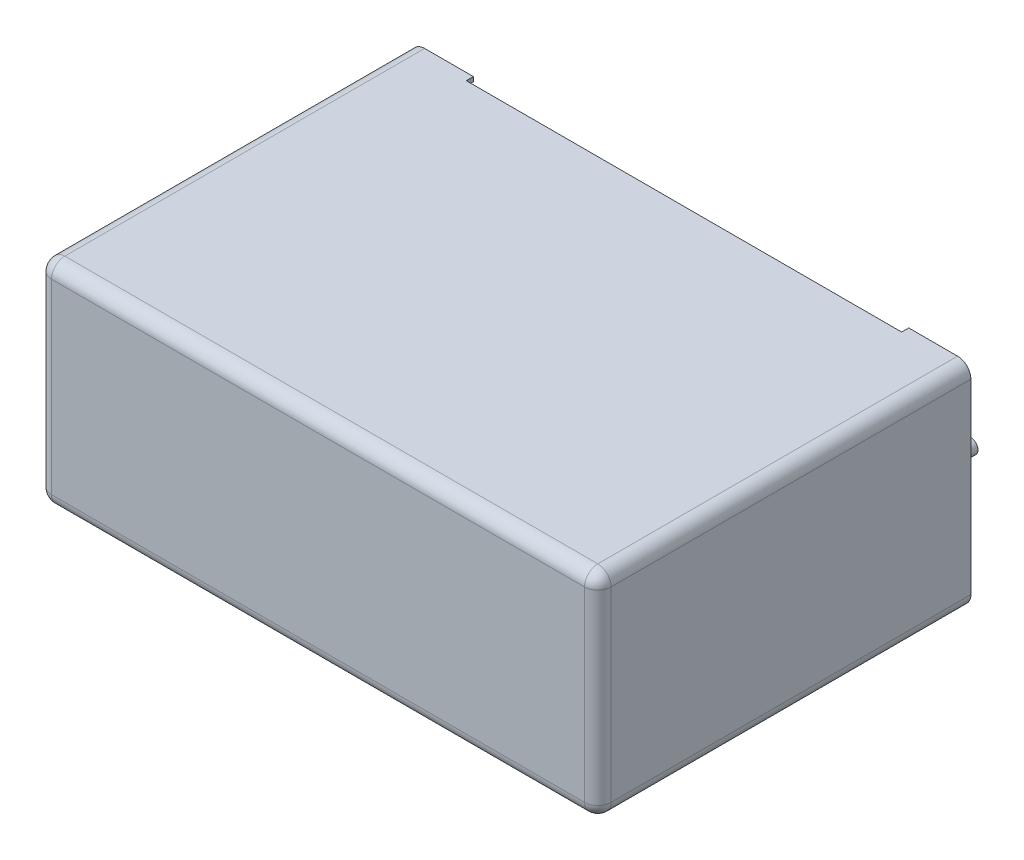
from build123d import *

# Parameters (mm, degrees)
SKETCH1_W               = 31.5
SKETCH1_H               = 12
EXTRUDE1_DEPTH          = 21
FILLET1_R               = 0.75
BOSS_EXTRUDE1_DEPTH     = 0.01
SKETCH4_W               = 31
SKETCH4_H               = 11.5
CUT_EXTRUDE1_DEPTH      = 0.5
CUT_EXTRUDE5_DEPTH      = 29.862822107
CUT_EXTRUDE5_DEPTH_BACK = 12
SKETCH5_W               = 24.5
SKETCH5_H               = 0.4
SKETCH2_R               = 0.4
EXTRUDE2_DEPTH          = 2.5


with BuildPart() as part:
    # Sketch1 → Extrude1 (new body)
    with BuildSketch(Plane.XY):
        Rectangle(SKETCH1_W, SKETCH1_H)
    extrude(amount=EXTRUDE1_DEPTH)

    # Fillet1
    fillet1_edges = [part.edges().sort_by_distance(p)[0] for p in [
        (15.75, 0, 21),
        (0, 6, 21),
        (-15.75, 0, 21),
        (0, -6, 21),
        (-15.75, 6, 10.5),
        (15.75, 6, 10.5),
        (15.75, -6, 10.5),
        (-15.75, -6, 10.5),
    ]]
    fillet(fillet1_edges, radius=FILLET1_R)

    # Sketch3 → Boss-Extrude1 (add)
    # profile 1 of 16: a face of its own
    with BuildSketch(Plane.XZ.offset(6)):
        Polygon((-4.080689103, 14.247652538), (-3.871121294, 15.835152538), (-3.85076873, 15.835152538), (-3.195352564, 14.532588435), (-2.541526442, 15.835152538), (-2.520855869, 15.835152538), (-2.310016026, 14.247652538), (-2.453119992, 14.247652538), (-2.605128205, 15.389940198), (-3.178180088, 14.247652538), (-3.210298978, 14.247652538), (-3.785576923, 15.392484269), (-3.937267127, 14.247652538), align=None)
    # profile 2 of 16: a face of its own
    with BuildSketch(Plane.XZ.offset(6)):
        Polygon((-1.984375, 15.835152538), (-1.841907051, 15.835152538), (-1.841907051, 15.230617782), (-1.180130709, 15.835152538), (-0.976923077, 15.835152538), (-1.756998698, 15.122812794), (-0.915865385, 14.247652538), (-1.105716647, 14.247652538), (-1.841907051, 15.013735771), (-1.841907051, 14.247652538), (-1.984375, 14.247652538), align=None)
    # profile 3 of 16: a face of its own
    with BuildSketch(Plane.XZ.offset(6)):
        with BuildLine():
            Line((-0.681810897, 15.835152538), (-0.370480268, 15.835152538))
            add(Edge.make_bspline(
                [(-0.370480268, 15.835152538), (-0.34906675, 15.835128999), (-0.308037499, 15.835083898), (-0.249202455, 15.833716496), (-0.195767327, 15.831890103), (-0.147847333, 15.829358316), (-0.105295031, 15.826366291), (-0.06830297, 15.82216983), (-0.036580386, 15.817788196), (-0.017572818, 15.813333487), (-0.008904247, 15.811301877)],
                knots=[0, 0, 0, 0, 1.415646017, 2.712440637, 3.8905458, 4.950247383, 5.884950622, 6.709939814, 7.411656543, 8, 8, 8, 8], degree=3))
            add(Edge.make_bspline(
                [(-0.008904247, 15.811301877), (0.002069249, 15.80829835), (0.023757664, 15.802362069), (0.055009208, 15.790472273), (0.084742559, 15.776374291), (0.113059731, 15.760307004), (0.139612747, 15.741581052), (0.164797773, 15.720955518), (0.188392549, 15.6979542), (0.210264395, 15.672835078), (0.230350714, 15.64601984), (0.247645249, 15.617108186), (0.262126526, 15.586586773), (0.274546796, 15.554476832), (0.283485988, 15.520508721), (0.290220117, 15.484918462), (0.294494406, 15.447709871), (0.294903782, 15.422282717), (0.295112179, 15.409338736)],
                knots=[0, 0, 0, 0, 0.999701418, 1.975846123, 2.934577507, 3.890451536, 4.834027766, 5.787354733, 6.749476667, 7.726910423, 8.712836071, 9.690891519, 10.682875813, 11.679750201, 12.712814741, 13.765529915, 14.8625177, 16, 16, 16, 16], degree=3))
            add(Edge.make_bspline(
                [(0.295112179, 15.409338736), (0.294921033, 15.396285958), (0.294547043, 15.370747318), (0.290058371, 15.333385375), (0.284012176, 15.297680962), (0.274715299, 15.263713247), (0.262538869, 15.231683951), (0.248254973, 15.201103607), (0.231026729, 15.17249247), (0.211230682, 15.14574667), (0.189209066, 15.120841103), (0.165055054, 15.097956249), (0.138866161, 15.077226067), (0.110725615, 15.058604083), (0.080359077, 15.042522128), (0.0482271, 15.028117921), (0.014050395, 15.01602069), (-0.00959996, 15.009657055), (-0.021624599, 15.006421568)],
                knots=[0, 0, 0, 0, 1.121902311, 2.195077645, 3.232258892, 4.234102512, 5.217864754, 6.176164875, 7.132989551, 8.084763148, 9.034132444, 9.988522005, 10.94243251, 11.903244335, 12.886203696, 13.894208494, 14.929344452, 16, 16, 16, 16], degree=3))
            add(Edge.make_bspline(
                [(-0.021624599, 15.006421568), (-0.031570212, 15.004306573), (-0.053366599, 14.999671439), (-0.089263477, 14.994496889), (-0.131057991, 14.990080191), (-0.178693096, 14.986768604), (-0.232126035, 14.983933615), (-0.291385713, 14.98168023), (-0.356588455, 14.980442046), (-0.402068626, 14.980378187), (-0.425813802, 14.980344846)],
                knots=[0, 0, 0, 0, 0.601384939, 1.31797006, 2.144135048, 3.087295005, 4.142315834, 5.309527816, 6.595305764, 8, 8, 8, 8], degree=3))
            Line((-0.425813802, 14.980344846), (-0.539342949, 14.980344846))
            Line((-0.539342949, 14.980344846), (-0.539342949, 14.247652538))
            Line((-0.539342949, 14.247652538), (-0.681810897, 14.247652538))
            Line((-0.681810897, 14.247652538), (-0.681810897, 15.835152538))
        make_face()
        with BuildLine():
            Line((-0.539342949, 15.672332025), (-0.539342949, 15.143165358))
            Line((-0.539342949, 15.143165358), (-0.261403245, 15.139667261))
            add(Edge.make_bspline(
                [(-0.261403245, 15.139667261), (-0.247832422, 15.139660248), (-0.221634227, 15.139646708), (-0.18378994, 15.141454291), (-0.148679299, 15.143540961), (-0.116410152, 15.146596184), (-0.086967953, 15.150914754), (-0.06030361, 15.155274364), (-0.036623878, 15.161581439), (-0.008911026, 15.170073688), (0.021969636, 15.18455741), (0.055564559, 15.205580396), (0.084035504, 15.232377717), (0.108672731, 15.262507484), (0.128224326, 15.296026017), (0.142537222, 15.331889428), (0.150946962, 15.369729917), (0.152074628, 15.395623465), (0.152644231, 15.408702718)],
                knots=[0, 0, 0, 0, 1.160613943, 2.240541288, 3.23993089, 4.169200891, 5.011653406, 5.7853311, 6.478053781, 7.106038997, 8.262395093, 9.384106736, 10.481365981, 11.59014053, 12.70357646, 13.786202915, 14.881775077, 16, 16, 16, 16], degree=3))
            add(Edge.make_bspline(
                [(0.152644231, 15.408702718), (0.15207153, 15.421465544), (0.150933073, 15.446836462), (0.142471306, 15.484019685), (0.128252153, 15.519505166), (0.108541484, 15.552603672), (0.084619614, 15.582625023), (0.056815983, 15.608704077), (0.02519604, 15.62966892), (-0.004217265, 15.643200445), (-0.030343517, 15.651462373), (-0.053036585, 15.657243069), (-0.078659141, 15.661858433), (-0.107219526, 15.665595636), (-0.138496376, 15.668794884), (-0.172758397, 15.670965667), (-0.2098758, 15.672236327), (-0.235643452, 15.672299354), (-0.249000901, 15.672332025)],
                knots=[0, 0, 0, 0, 1.120700087, 2.227813068, 3.331159281, 4.466773991, 5.599788987, 6.693661531, 7.80175334, 8.91857717, 9.525282508, 10.207424825, 10.974604443, 11.810962634, 12.737642355, 13.736264703, 14.826523623, 16, 16, 16, 16], degree=3))
            Line((-0.249000901, 15.672332025), (-0.539342949, 15.672332025))
        make_face(mode=Mode.SUBTRACT)
    # profile 4 of 16: a face of its own
    with BuildSketch(Plane.XZ.offset(6)):
        Polygon((1.119391026, 15.835152538), (1.283801583, 15.835152538), (1.699439103, 15.185778539), (2.115076623, 15.835152538), (2.279487179, 15.835152538), (1.781803385, 15.057302979), (2.299839744, 14.247652538), (2.135429187, 14.247652538), (1.699439103, 14.928827418), (1.263449018, 14.247652538), (1.099038462, 14.247652538), (1.617392829, 15.057302979), align=None)
    # profile 5 of 16: a face of its own
    with BuildSketch(Plane.XZ.offset(6)):
        with BuildLine():
            Line((2.635657051, 15.346690999), (2.493189103, 15.346690999))
            add(Edge.make_bspline(
                [(2.493189103, 15.346690999), (2.494117633, 15.365591724), (2.495941241, 15.402712243), (2.504481215, 15.456834157), (2.516700827, 15.508566155), (2.533978023, 15.557492866), (2.555434799, 15.604046897), (2.581165918, 15.648043332), (2.611643129, 15.689314336), (2.646208326, 15.727477311), (2.683749816, 15.762487388), (2.724256438, 15.792720302), (2.766821862, 15.818264388), (2.811316946, 15.839619094), (2.858243702, 15.855648239), (2.907176284, 15.867541625), (2.958329678, 15.874697325), (2.993182116, 15.875466485), (3.010907452, 15.875857666)],
                knots=[0, 0, 0, 0, 1.10065271, 2.161652631, 3.183658789, 4.190468796, 5.17591951, 6.163126047, 7.15150782, 8.156236427, 9.156009102, 10.134482811, 11.092018607, 12.041330605, 13.001268258, 13.972401359, 14.968799086, 16, 16, 16, 16], degree=3))
            add(Edge.make_bspline(
                [(3.010907452, 15.875857666), (3.02831465, 15.875450152), (3.062519172, 15.874649401), (3.112440157, 15.867772791), (3.159964144, 15.857002469), (3.204998238, 15.841891549), (3.247183132, 15.821578612), (3.286835727, 15.797177585), (3.324428095, 15.768956448), (3.3582676, 15.735730611), (3.389340908, 15.700260243), (3.416148002, 15.662392516), (3.439104687, 15.623281375), (3.458239813, 15.582628584), (3.47232599, 15.540051368), (3.483020392, 15.496169601), (3.489065326, 15.450529061), (3.489993071, 15.419637874), (3.490464744, 15.403932586)],
                knots=[0, 0, 0, 0, 1.111607364, 2.184268762, 3.212621178, 4.221274766, 5.211760367, 6.196651075, 7.1921475, 8.207485113, 9.220403448, 10.201281604, 11.166441695, 12.114753415, 13.065576456, 14.026450734, 14.996634279, 16, 16, 16, 16], degree=3))
            add(Edge.make_bspline(
                [(3.490464744, 15.403932586), (3.489696728, 15.381821961), (3.488174174, 15.337988721), (3.475150153, 15.273574837), (3.454809057, 15.211166393), (3.430317399, 15.160939117), (3.405610255, 15.120465354), (3.383345564, 15.087142048), (3.357281167, 15.051262068), (3.327037706, 15.012945561), (3.293240796, 14.971892401), (3.255584315, 14.928127387), (3.213799735, 14.882102691), (3.184472487, 14.85066765), (3.169275841, 14.8343788)],
                knots=[0, 0, 0, 0, 1.184426356, 2.348067706, 3.509069118, 4.696110526, 5.333549288, 6.050745305, 6.844228056, 7.710549037, 8.667450064, 9.695053472, 10.805634456, 12, 12, 12, 12], degree=3))
            Line((3.169275841, 14.8343788), (2.772082833, 14.410473051))
            Line((2.772082833, 14.410473051), (3.510817308, 14.410473051))
            Line((3.510817308, 14.410473051), (3.510817308, 14.247652538))
            Line((3.510817308, 14.247652538), (2.43213141, 14.247652538))
            Line((2.43213141, 14.247652538), (3.047796474, 14.904658748))
            add(Edge.make_bspline(
                [(3.047796474, 14.904658748), (3.062786052, 14.920306194), (3.091577962, 14.950361736), (3.132300773, 14.994241578), (3.168876314, 15.034949406), (3.201541346, 15.072408305), (3.229587258, 15.107166194), (3.254475734, 15.138097363), (3.27441727, 15.166560989), (3.29605961, 15.199554053), (3.317020952, 15.239836783), (3.335033342, 15.289064563), (3.346016505, 15.339740853), (3.347334056, 15.37398642), (3.347996795, 15.391212233)],
                knots=[0, 0, 0, 0, 1.329631726, 2.553950428, 3.673215718, 4.687767853, 5.603093632, 6.413772471, 7.123043292, 7.734684054, 8.834405432, 9.900288307, 10.943827018, 12, 12, 12, 12], degree=3))
            add(Edge.make_bspline(
                [(3.347996795, 15.391212233), (3.34770844, 15.402044153), (3.347140149, 15.423391788), (3.342124693, 15.454690828), (3.334545285, 15.484882726), (3.3236844, 15.51406035), (3.309348486, 15.541930342), (3.29189806, 15.568526628), (3.271763996, 15.594239123), (3.248472527, 15.61834794), (3.222885873, 15.640428344), (3.195855624, 15.659988197), (3.167257899, 15.676334508), (3.137213272, 15.689734594), (3.105805505, 15.700246285), (3.072973853, 15.707529998), (3.038809031, 15.712103124), (3.015480267, 15.712721874), (3.003593249, 15.713037153)],
                knots=[0, 0, 0, 0, 0.991446411, 1.95395049, 2.89581595, 3.838931463, 4.798493298, 5.75982156, 6.748411868, 7.785213223, 8.824556874, 9.840280684, 10.836137867, 11.835679398, 12.848801643, 13.863922112, 14.911575587, 16, 16, 16, 16], degree=3))
            add(Edge.make_bspline(
                [(3.003593249, 15.713037153), (2.991178621, 15.712712835), (2.966798342, 15.712075928), (2.931002924, 15.707620648), (2.896855446, 15.699934499), (2.864270012, 15.689422222), (2.833191485, 15.676060665), (2.803771008, 15.659418338), (2.776074626, 15.639559397), (2.750050275, 15.617043859), (2.726072684, 15.591976054), (2.705005708, 15.564031535), (2.686597959, 15.533720529), (2.670537342, 15.501124822), (2.657494583, 15.465948643), (2.64752819, 15.428316863), (2.639642013, 15.388392879), (2.637007434, 15.360822501), (2.635657051, 15.346690999)],
                knots=[0, 0, 0, 0, 1.031018746, 2.02475058, 2.990194455, 3.934040569, 4.864654155, 5.795059489, 6.735614925, 7.690564532, 8.649604399, 9.611025574, 10.590972636, 11.591080095, 12.624614302, 13.701020113, 14.821632451, 16, 16, 16, 16], degree=3))
        make_face()
    # profile 6 of 16: a face of its own
    with BuildSketch(Plane.XZ.offset(6)):
        Polygon((-2.410188802, 12.230024333), (-2.38125, 12.230024333), (-2.38125, 11.130985871), (-2.198076923, 11.130985871), (-2.198076923, 10.968165358), (-2.38125, 10.968165358), (-2.38125, 10.601819205), (-2.523717949, 10.601819205), (-2.523717949, 10.968165358), (-3.276762821, 10.968165358), align=None)
        Polygon((-2.523717949, 11.130985871), (-2.523717949, 11.82042898), (-2.996915064, 11.130985871), align=None, mode=Mode.SUBTRACT)
    # profile 7 of 16: a face of its own
    with BuildSketch(Plane.XZ.offset(6)):
        Polygon((-1.953846154, 12.189319205), (-0.976923077, 12.189319205), (-1.811378205, 10.561114076), (-1.934447616, 10.628849954), (-1.217973758, 12.026498692), (-1.953846154, 12.026498692), align=None)
    # profile 8 of 16: a face of its own
    with BuildSketch(Plane.XZ.offset(6)):
        with BuildLine():
            add(Edge.make_bspline(
                [(-0.834455128, 11.394933187), (-0.834306349, 11.420377359), (-0.834017342, 11.469803031), (-0.830802237, 11.541823208), (-0.825461278, 11.609387339), (-0.818141827, 11.672498658), (-0.8092346, 11.731173458), (-0.797344004, 11.785254937), (-0.783821769, 11.834993402), (-0.768149766, 11.880551045), (-0.750466019, 11.922541646), (-0.731219051, 11.961741648), (-0.709645019, 11.998091739), (-0.686976919, 12.032172094), (-0.662297158, 12.063424841), (-0.636308064, 12.092291335), (-0.607995285, 12.118104425), (-0.578321277, 12.141620426), (-0.547017381, 12.162235008), (-0.514975886, 12.180392715), (-0.481976249, 12.195904797), (-0.447928373, 12.208101531), (-0.413138284, 12.218175736), (-0.377484365, 12.225065009), (-0.340907746, 12.229399749), (-0.316219202, 12.229814163), (-0.303698417, 12.230024333)],
                knots=[0, 0, 0, 0, 1.646270934, 3.197905019, 4.663502075, 6.030701355, 7.308322542, 8.50163776, 9.611534131, 10.641858119, 11.616356847, 12.558055219, 13.465016945, 14.349605745, 15.204443733, 16.039544428, 16.859896111, 17.680448484, 18.487036065, 19.28249412, 20.06191084, 20.843045899, 21.620316918, 22.403196591, 23.190181807, 24, 24, 24, 24], degree=3))
            add(Edge.make_bspline(
                [(-0.303698417, 12.230024333), (-0.29107304, 12.229803074), (-0.265965136, 12.229363059), (-0.22884468, 12.225133985), (-0.192581788, 12.218116726), (-0.157331061, 12.208173998), (-0.122802942, 12.195838816), (-0.0892675, 12.180377874), (-0.056516431, 12.162380673), (-0.025070194, 12.141233415), (0.005416436, 12.117655739), (0.034194619, 12.091002672), (0.061266976, 12.061543335), (0.086973275, 12.029592918), (0.110584206, 11.994538612), (0.133069299, 11.956990105), (0.153195187, 11.916290748), (0.172578414, 11.873119607), (0.189309297, 11.826282162), (0.204397916, 11.776042431), (0.216589448, 11.721806997), (0.226744582, 11.663860414), (0.234611732, 11.601989877), (0.240341537, 11.536328012), (0.243368258, 11.466831621), (0.243938262, 11.419316454), (0.244230769, 11.394933187)],
                knots=[0, 0, 0, 0, 0.810914788, 1.612654377, 2.396697861, 3.181598691, 3.963628158, 4.749916497, 5.551656086, 6.361998678, 7.18212741, 8.025565596, 8.878627764, 9.750805457, 10.657531673, 11.591944965, 12.560506719, 13.57287815, 14.630710178, 15.753379473, 16.941251878, 18.199788006, 19.531962791, 20.947069417, 22.433333509, 24, 24, 24, 24], degree=3))
            add(Edge.make_bspline(
                [(0.244230769, 11.394933187), (0.243935229, 11.370656272), (0.243359381, 11.323353692), (0.240375468, 11.25417), (0.234497803, 11.188856601), (0.227145415, 11.127256856), (0.2169623, 11.06962715), (0.204441385, 11.015768061), (0.190539275, 10.965447), (0.173378493, 10.91907621), (0.154595778, 10.876008822), (0.134160028, 10.835791937), (0.112266214, 10.798070083), (0.088413462, 10.763145197), (0.062989235, 10.730769878), (0.035449381, 10.701515599), (0.006570223, 10.674677473), (-0.024006123, 10.650796199), (-0.055942791, 10.629893448), (-0.088581372, 10.611200023), (-0.122500978, 10.596126622), (-0.156932924, 10.583183943), (-0.192369719, 10.573295881), (-0.228767189, 10.566458811), (-0.265940196, 10.561663722), (-0.291068763, 10.561297926), (-0.303698417, 10.561114076)],
                knots=[0, 0, 0, 0, 1.561518951, 3.042555995, 4.452378317, 5.7783523, 7.031515105, 8.214008947, 9.334062868, 10.386615937, 11.391082383, 12.354592575, 13.286541444, 14.194233754, 15.072674879, 15.931287219, 16.775624067, 17.606195743, 18.42308326, 19.229000347, 20.022332153, 20.807536673, 21.593273796, 22.3848459, 23.188221202, 24, 24, 24, 24], degree=3))
            add(Edge.make_bspline(
                [(-0.303698417, 10.561114076), (-0.316218855, 10.561325602), (-0.340906714, 10.561742689), (-0.377488349, 10.566057846), (-0.412995029, 10.572995449), (-0.447601964, 10.582709409), (-0.481486705, 10.594599709), (-0.514187521, 10.610090844), (-0.546068006, 10.627931654), (-0.577043104, 10.648249578), (-0.606530763, 10.671527627), (-0.634696916, 10.697274286), (-0.660833978, 10.726132048), (-0.685160872, 10.757645249), (-0.708281262, 10.791523969), (-0.729548942, 10.828230767), (-0.749220722, 10.867620094), (-0.767201877, 10.909946432), (-0.783144306, 10.955827417), (-0.79722666, 11.005787937), (-0.808345581, 11.060268958), (-0.81786285, 11.118832907), (-0.825539267, 11.181731439), (-0.830779978, 11.248998703), (-0.834019075, 11.32059278), (-0.834307125, 11.369700856), (-0.834455128, 11.394933187)],
                knots=[0, 0, 0, 0, 0.810891512, 1.598919785, 2.382837074, 3.152667961, 3.926044502, 4.706494248, 5.493654104, 6.291793342, 7.103789334, 7.925228297, 8.761435821, 9.622817696, 10.50288917, 11.416980706, 12.369136599, 13.353924996, 14.394355917, 15.514179734, 16.714354668, 17.994756427, 19.357759367, 20.818452758, 22.365282078, 24, 24, 24, 24], degree=3))
        make_face()
        with BuildLine():
            add(Edge.make_bspline(
                [(-0.691987179, 11.395569205), (-0.691933002, 11.37436533), (-0.691827853, 11.333212774), (-0.689080934, 11.273412438), (-0.685338864, 11.21763661), (-0.680512276, 11.165814471), (-0.67334451, 11.118121429), (-0.665313217, 11.074229466), (-0.655539619, 11.034370862), (-0.643975807, 10.998272105), (-0.630804503, 10.965320563), (-0.616423629, 10.934658583), (-0.600974658, 10.905923955), (-0.583684901, 10.879374783), (-0.564854854, 10.854924487), (-0.54490984, 10.832140309), (-0.523105489, 10.811821679), (-0.492941292, 10.787452712), (-0.453119319, 10.762270819), (-0.402945042, 10.740342414), (-0.35138828, 10.7265618), (-0.316394677, 10.724809311), (-0.298928285, 10.723934589)],
                knots=[0, 0, 0, 0, 1.459021318, 2.831673884, 4.118529203, 5.306027144, 6.411944654, 7.436330062, 8.375795394, 9.233974572, 10.042671642, 10.816086306, 11.563610507, 12.285937304, 12.993564865, 13.685989202, 14.367179055, 15.041617293, 16.353048772, 17.594441528, 18.799311195, 20, 20, 20, 20], degree=3))
            add(Edge.make_bspline(
                [(-0.298928285, 10.723934589), (-0.281348913, 10.724659297), (-0.246226463, 10.726107216), (-0.194912206, 10.740076643), (-0.145096333, 10.761153899), (-0.10605656, 10.786076517), (-0.076355549, 10.809811152), (-0.055075343, 10.830047082), (-0.035543628, 10.852705636), (-0.01701883, 10.877152817), (-2.8464e-05, 10.903855694), (0.015421602, 10.932685862), (0.029520121, 10.963723382), (0.037552438, 10.985390371), (0.041659155, 10.996468143)],
                knots=[0, 0, 0, 0, 1.353760809, 2.704726607, 4.075137775, 5.516104923, 6.260822281, 7.007110065, 7.778089737, 8.566572457, 9.372053459, 10.217411131, 11.088608312, 12, 12, 12, 12], degree=3))
            add(Edge.make_bspline(
                [(0.041659155, 10.996468143), (0.046445135, 11.01063306), (0.056162728, 11.039393918), (0.06868664, 11.08400886), (0.078549731, 11.130818685), (0.087423115, 11.179543649), (0.09347968, 11.230543084), (0.098354581, 11.283659194), (0.101226, 11.338932026), (0.10158194, 11.376485469), (0.101762821, 11.395569205)],
                knots=[0, 0, 0, 0, 0.884706709, 1.796334032, 2.740027952, 3.714592787, 4.726048262, 5.777819803, 6.87074269, 8, 8, 8, 8], degree=3))
            add(Edge.make_bspline(
                [(0.101762821, 11.395569205), (0.10151327, 11.414649854), (0.101025097, 11.451975682), (0.09915911, 11.506639285), (0.09434056, 11.558558591), (0.088988817, 11.60795727), (0.081097934, 11.654561871), (0.072589929, 11.698762545), (0.061159379, 11.740011703), (0.048949338, 11.778955156), (0.034974623, 11.815150453), (0.019591415, 11.848766349), (0.00316226, 11.879965135), (-0.014682256, 11.908661212), (-0.033730298, 11.934983115), (-0.054484615, 11.958403092), (-0.076121955, 11.979647003), (-0.106428322, 12.003896097), (-0.14610416, 12.028621044), (-0.195473436, 12.0513748), (-0.246849764, 12.064441418), (-0.281581295, 12.066283683), (-0.298928285, 12.06720382)],
                knots=[0, 0, 0, 0, 1.31362396, 2.569729283, 3.763502607, 4.902122613, 5.988968491, 7.01645872, 7.998833611, 8.933434873, 9.825090667, 10.667526885, 11.477055099, 12.250526234, 12.991942729, 13.710640831, 14.402115721, 15.076753259, 16.378508321, 17.609869233, 18.806226677, 20, 20, 20, 20], degree=3))
            add(Edge.make_bspline(
                [(-0.298928285, 12.06720382), (-0.316486304, 12.066282414), (-0.351634327, 12.064437923), (-0.40354465, 12.051423483), (-0.453303409, 12.02873903), (-0.49287433, 12.003814204), (-0.523201833, 11.980075042), (-0.544557198, 11.959489043), (-0.56458064, 11.93697092), (-0.583026347, 11.912295766), (-0.600302557, 11.885777546), (-0.616168945, 11.857207642), (-0.630464305, 11.826441273), (-0.64365622, 11.793504533), (-0.655255306, 11.75740889), (-0.664822925, 11.717599382), (-0.673661696, 11.673847024), (-0.679918835, 11.625895676), (-0.685481325, 11.574060556), (-0.689056079, 11.518145487), (-0.691837042, 11.458244857), (-0.691936131, 11.416879525), (-0.691987179, 11.395569205)],
                knots=[0, 0, 0, 0, 1.207732386, 2.417664972, 3.655092373, 4.956220595, 5.625982001, 6.301752483, 6.994047911, 7.697131622, 8.419323945, 9.170223765, 9.943494443, 10.752040957, 11.610060368, 12.549350801, 13.567764191, 14.679664412, 15.874934091, 17.154273443, 18.533957287, 20, 20, 20, 20], degree=3))
        make_face(mode=Mode.SUBTRACT)
    # profile 9 of 16: a face of its own
    with BuildSketch(Plane.XZ.offset(6)):
        with BuildLine():
            Line((0.488461538, 11.761915358), (0.630929487, 11.761915358))
            Line((0.630929487, 11.761915358), (0.630929487, 11.552665559))
            add(Edge.make_bspline(
                [(0.630929487, 11.552665559), (0.6461412, 11.571644222), (0.67566006, 11.608472981), (0.724820097, 11.656878385), (0.776773938, 11.696767826), (0.831203418, 11.728564904), (0.888182426, 11.752534624), (0.947363641, 11.769845599), (1.009101383, 11.780225504), (1.051085967, 11.781581787), (1.072325721, 11.782267922)],
                knots=[0, 0, 0, 0, 1.12780773, 2.188550248, 3.19190651, 4.159438251, 5.104880172, 6.052711206, 7.014878035, 8, 8, 8, 8], degree=3))
            add(Edge.make_bspline(
                [(1.072325721, 11.782267922), (1.093793544, 11.781476352), (1.135811253, 11.779927057), (1.196988088, 11.767673058), (1.25412602, 11.746742888), (1.307021319, 11.718071699), (1.354704019, 11.682418049), (1.396579934, 11.640880983), (1.431216121, 11.593103546), (1.454437782, 11.548779114), (1.469734772, 11.509459554), (1.479365154, 11.475783349), (1.487543492, 11.438264759), (1.494633606, 11.39701716), (1.499431082, 11.351751552), (1.503214907, 11.302653492), (1.505926672, 11.249738883), (1.506034262, 11.213141734), (1.506089744, 11.194269625)],
                knots=[0, 0, 0, 0, 1.235846778, 2.418850247, 3.575807741, 4.728682307, 5.871620074, 6.994088408, 8.11269785, 9.256955736, 9.865816715, 10.540099792, 11.271859618, 12.076849838, 12.949306005, 13.892391288, 14.913166135, 16, 16, 16, 16], degree=3))
            Line((1.506089744, 11.194269625), (1.506089744, 10.601819205))
            Line((1.506089744, 10.601819205), (1.363621795, 10.601819205))
            Line((1.363621795, 10.601819205), (1.363621795, 11.14752233))
            add(Edge.make_bspline(
                [(1.363621795, 11.14752233), (1.363534161, 11.163316796), (1.363366533, 11.193528921), (1.362837829, 11.236785585), (1.361563381, 11.276013426), (1.359772539, 11.311118661), (1.357151336, 11.342067579), (1.354419642, 11.368923216), (1.351079099, 11.391651472), (1.348102349, 11.405333492), (1.346767328, 11.411469645)],
                knots=[0, 0, 0, 0, 1.430800155, 2.736877192, 3.918605307, 4.986035426, 5.920637409, 6.731861385, 7.431261377, 8, 8, 8, 8], degree=3))
            add(Edge.make_bspline(
                [(1.346767328, 11.411469645), (1.34194789, 11.429481504), (1.332671964, 11.46414876), (1.309751193, 11.511172484), (1.280806904, 11.551176662), (1.245474665, 11.583913961), (1.204095763, 11.609391447), (1.156785023, 11.62706892), (1.103998997, 11.638125299), (1.066872188, 11.639226177), (1.047521034, 11.639799974)],
                knots=[0, 0, 0, 0, 1.084156227, 2.086665306, 3.027808233, 3.945421172, 4.874247719, 5.839848303, 6.874090471, 8, 8, 8, 8], degree=3))
            add(Edge.make_bspline(
                [(1.047521034, 11.639799974), (1.036060334, 11.639584072), (1.013379906, 11.639156807), (0.979747598, 11.634869968), (0.947124848, 11.627858454), (0.915184253, 11.618393037), (0.884564647, 11.60539265), (0.854282272, 11.590638257), (0.825477418, 11.572246747), (0.797535877, 11.551749572), (0.771540425, 11.529035075), (0.747352214, 11.505066315), (0.725790327, 11.479541309), (0.706255606, 11.452871332), (0.689392608, 11.424690106), (0.674672814, 11.39526951), (0.66218341, 11.364570821), (0.655977332, 11.343264275), (0.652872095, 11.332603459)],
                knots=[0, 0, 0, 0, 1.023777757, 2.026029729, 3.023749952, 4.003683103, 4.997618607, 5.993177895, 7.010360494, 8.046726602, 9.087585522, 10.09234134, 11.086953743, 12.070360549, 13.043493632, 14.017870808, 15.008233677, 16, 16, 16, 16], degree=3))
            add(Edge.make_bspline(
                [(0.652872095, 11.332603459), (0.651085183, 11.324776992), (0.647195169, 11.307739183), (0.642993656, 11.279779035), (0.63918022, 11.247434868), (0.635988456, 11.210744424), (0.634035642, 11.169579245), (0.631906398, 11.124115133), (0.631131217, 11.074170801), (0.630998613, 11.039399247), (0.630929487, 11.02127283)],
                knots=[0, 0, 0, 0, 0.615963638, 1.340920617, 2.168419149, 3.115676021, 4.16674242, 5.331190069, 6.6087489, 8, 8, 8, 8], degree=3))
            Line((0.630929487, 11.02127283), (0.630929487, 10.601819205))
            Line((0.630929487, 10.601819205), (0.488461538, 10.601819205))
            Line((0.488461538, 10.601819205), (0.488461538, 11.761915358))
        make_face()
    # profile 10 of 16: a face of its own
    with BuildSketch(Plane.XZ.offset(6)):
        Polygon((1.872435897, 12.189319205), (2.645833333, 12.189319205), (2.645833333, 12.026498692), (2.014903846, 12.026498692), (2.014903846, 11.538037153), (2.645833333, 11.538037153), (2.645833333, 11.37521664), (2.014903846, 11.37521664), (2.014903846, 10.601819205), (1.872435897, 10.601819205), align=None)
    # profile 11 of 16: a face of its own
    with BuildSketch(Plane.XZ.offset(6)):
        with BuildLine():
            Line((-4.365625, 8.055024333), (-4.508092949, 8.055024333))
            add(Edge.make_bspline(
                [(-4.508092949, 8.055024333), (-4.507164419, 8.073925057), (-4.50534081, 8.111045576), (-4.496800836, 8.165167491), (-4.484581224, 8.216899489), (-4.467304029, 8.2658262), (-4.445847253, 8.31238023), (-4.420116133, 8.356376666), (-4.389638922, 8.397647669), (-4.355073725, 8.435810645), (-4.317532235, 8.470820721), (-4.277025613, 8.501053635), (-4.23446019, 8.526597722), (-4.189965105, 8.547952428), (-4.14303835, 8.563981572), (-4.094105768, 8.575874959), (-4.042952374, 8.583030658), (-4.008099935, 8.583799818), (-3.990374599, 8.584190999)],
                knots=[0, 0, 0, 0, 1.10065271, 2.161652631, 3.183658789, 4.190468796, 5.17591951, 6.163126047, 7.15150782, 8.156236427, 9.156009102, 10.134482811, 11.092018607, 12.041330605, 13.001268258, 13.972401359, 14.968799086, 16, 16, 16, 16], degree=3))
            add(Edge.make_bspline(
                [(-3.990374599, 8.584190999), (-3.972967401, 8.583783485), (-3.938762879, 8.582982734), (-3.888841894, 8.576106125), (-3.841317907, 8.565335803), (-3.796283813, 8.550224882), (-3.754098919, 8.529911945), (-3.714446324, 8.505510919), (-3.676853957, 8.477289781), (-3.643014451, 8.444063944), (-3.611941144, 8.408593577), (-3.585134049, 8.370725849), (-3.562177365, 8.331614709), (-3.543042238, 8.290961917), (-3.528956061, 8.248384701), (-3.51826166, 8.204502934), (-3.512216725, 8.158862395), (-3.51128898, 8.127971207), (-3.510817308, 8.112265919)],
                knots=[0, 0, 0, 0, 1.111607364, 2.184268762, 3.212621178, 4.221274766, 5.211760367, 6.196651075, 7.1921475, 8.207485113, 9.220403448, 10.201281604, 11.166441695, 12.114753415, 13.065576456, 14.026450734, 14.996634279, 16, 16, 16, 16], degree=3))
            add(Edge.make_bspline(
                [(-3.510817308, 8.112265919), (-3.511585323, 8.090155294), (-3.513107877, 8.046322055), (-3.526131898, 7.98190817), (-3.546472994, 7.919499727), (-3.570964652, 7.86927245), (-3.595671797, 7.828798687), (-3.617936487, 7.795475382), (-3.644000884, 7.759595401), (-3.674244345, 7.721278895), (-3.708041255, 7.680225734), (-3.745697737, 7.63646072), (-3.787482316, 7.590436024), (-3.816809564, 7.559000984), (-3.83200621, 7.542712133)],
                knots=[0, 0, 0, 0, 1.184426356, 2.348067706, 3.509069118, 4.696110526, 5.333549288, 6.050745305, 6.844228056, 7.710549037, 8.667450064, 9.695053472, 10.805634456, 12, 12, 12, 12], degree=3))
            Line((-3.83200621, 7.542712133), (-4.229199219, 7.118806384))
            Line((-4.229199219, 7.118806384), (-3.490464744, 7.118806384))
            Line((-3.490464744, 7.118806384), (-3.490464744, 6.955985871))
            Line((-3.490464744, 6.955985871), (-4.569150641, 6.955985871))
            Line((-4.569150641, 6.955985871), (-3.953485577, 7.612992081))
            add(Edge.make_bspline(
                [(-3.953485577, 7.612992081), (-3.938496, 7.628639527), (-3.90970409, 7.658695069), (-3.868981278, 7.702574912), (-3.832405737, 7.743282739), (-3.799740705, 7.780741638), (-3.771694794, 7.815499528), (-3.746806317, 7.846430697), (-3.726864781, 7.874894322), (-3.705222441, 7.907887387), (-3.684261099, 7.948170116), (-3.666248709, 7.997397897), (-3.655265546, 8.048074186), (-3.653947996, 8.082319753), (-3.653285256, 8.099545567)],
                knots=[0, 0, 0, 0, 1.329631726, 2.553950428, 3.673215718, 4.687767853, 5.603093632, 6.413772471, 7.123043292, 7.734684054, 8.834405432, 9.900288307, 10.943827018, 12, 12, 12, 12], degree=3))
            add(Edge.make_bspline(
                [(-3.653285256, 8.099545567), (-3.653573611, 8.110377487), (-3.654141902, 8.131725121), (-3.659157358, 8.163024162), (-3.666736766, 8.193216059), (-3.677597651, 8.222393683), (-3.691933565, 8.250263675), (-3.709383991, 8.276859961), (-3.729518056, 8.302572456), (-3.752809524, 8.326681273), (-3.778396178, 8.348761677), (-3.805426427, 8.36832153), (-3.834024153, 8.384667841), (-3.86406878, 8.398067927), (-3.895476546, 8.408579618), (-3.928308198, 8.415863331), (-3.96247302, 8.420436458), (-3.985801784, 8.421055207), (-3.997688802, 8.421370487)],
                knots=[0, 0, 0, 0, 0.991446411, 1.95395049, 2.89581595, 3.838931463, 4.798493298, 5.75982156, 6.748411868, 7.785213223, 8.824556874, 9.840280684, 10.836137867, 11.835679398, 12.848801643, 13.863922112, 14.911575587, 16, 16, 16, 16], degree=3))
            add(Edge.make_bspline(
                [(-3.997688802, 8.421370487), (-4.01010343, 8.421046168), (-4.034483709, 8.420409261), (-4.070279127, 8.415953981), (-4.104426605, 8.408267832), (-4.13701204, 8.397755555), (-4.168090566, 8.384393999), (-4.197511043, 8.367751672), (-4.225207425, 8.34789273), (-4.251231777, 8.325377192), (-4.275209367, 8.300309387), (-4.296276343, 8.272364868), (-4.314684092, 8.242053862), (-4.330744709, 8.209458155), (-4.343787468, 8.174281976), (-4.353753862, 8.136650196), (-4.361640038, 8.096726212), (-4.364274617, 8.069155835), (-4.365625, 8.055024333)],
                knots=[0, 0, 0, 0, 1.031018746, 2.02475058, 2.990194455, 3.934040569, 4.864654155, 5.795059489, 6.735614925, 7.690564532, 8.649604399, 9.611025574, 10.590972636, 11.591080095, 12.624614302, 13.701020113, 14.821632451, 16, 16, 16, 16], degree=3))
        make_face()
    # profile 12 of 16: a face of its own
    with BuildSketch(Plane.XZ.offset(6)):
        with BuildLine():
            Line((-2.350721154, 8.543485871), (-2.350721154, 8.380665358))
            Line((-2.350721154, 8.380665358), (-2.89070012, 8.380665358))
            Line((-2.89070012, 8.380665358), (-2.976244491, 7.963119785))
            add(Edge.make_bspline(
                [(-2.976244491, 7.963119785), (-2.959437005, 7.967759944), (-2.92687516, 7.976749519), (-2.878814794, 7.986730707), (-2.833189045, 7.992747534), (-2.803582002, 7.993569092), (-2.789255308, 7.99396664)],
                knots=[0, 0, 0, 0, 1.100273476, 2.13160584, 3.095893838, 4, 4, 4, 4], degree=3))
            add(Edge.make_bspline(
                [(-2.789255308, 7.99396664), (-2.771528041, 7.993582948), (-2.736671803, 7.992828513), (-2.68567271, 7.985584139), (-2.636989576, 7.974181392), (-2.590724215, 7.958251727), (-2.546791037, 7.937881955), (-2.50559425, 7.912436625), (-2.466515482, 7.882712578), (-2.430255806, 7.848538233), (-2.397360852, 7.810927357), (-2.368438421, 7.770487894), (-2.343871817, 7.727612847), (-2.324113903, 7.681892571), (-2.308336723, 7.633832527), (-2.29783564, 7.582927034), (-2.290843061, 7.529655922), (-2.290061836, 7.493232064), (-2.289663462, 7.474658247)],
                knots=[0, 0, 0, 0, 1.052922333, 2.070308379, 3.05430497, 4.020497103, 4.973039431, 5.925935799, 6.892292201, 7.88610001, 8.88166317, 9.857072816, 10.836096531, 11.812156883, 12.81219415, 13.836441305, 14.89672472, 16, 16, 16, 16], degree=3))
            add(Edge.make_bspline(
                [(-2.289663462, 7.474658247), (-2.289965121, 7.461721383), (-2.290564362, 7.436022485), (-2.293611722, 7.39785708), (-2.299478993, 7.360499652), (-2.307356496, 7.323945245), (-2.317581093, 7.288263066), (-2.329958628, 7.25335098), (-2.345106112, 7.219426283), (-2.361721057, 7.186167979), (-2.380429281, 7.154327942), (-2.401193104, 7.124551437), (-2.423130309, 7.096391781), (-2.446734795, 7.070150981), (-2.47222596, 7.046001469), (-2.499295088, 7.023799927), (-2.527726179, 7.003170895), (-2.557959092, 6.98495175), (-2.589320147, 6.968186409), (-2.622262231, 6.954432519), (-2.656035477, 6.942135958), (-2.691125975, 6.932334493), (-2.72745424, 6.92465437), (-2.765080156, 6.919438026), (-2.803806388, 6.915638714), (-2.83005684, 6.91540088), (-2.843316807, 6.915280743)],
                knots=[0, 0, 0, 0, 1.056347294, 2.098418968, 3.122841568, 4.141288669, 5.149314143, 6.15115421, 7.162517403, 8.180376062, 9.185164535, 10.17417709, 11.141909838, 12.097768115, 13.052685741, 14.0056014, 14.954263652, 15.917497458, 16.885230207, 17.854509472, 18.828990115, 19.81800267, 20.826176721, 21.857883937, 22.917946725, 24, 24, 24, 24], degree=3))
            add(Edge.make_bspline(
                [(-2.843316807, 6.915280743), (-2.859134739, 6.915594087), (-2.890254651, 6.916210555), (-2.935847909, 6.922659654), (-2.97971489, 6.931896145), (-3.021502472, 6.945791881), (-3.061585152, 6.963203262), (-3.099423314, 6.985208811), (-3.135983791, 7.010145761), (-3.169780322, 7.039573636), (-3.201147559, 7.071738963), (-3.229226582, 7.10664475), (-3.254233598, 7.14371489), (-3.275768147, 7.18312941), (-3.294136892, 7.224784744), (-3.308567262, 7.268836962), (-3.32021423, 7.315055892), (-3.325141567, 7.34687552), (-3.327644231, 7.363037153)],
                knots=[0, 0, 0, 0, 1.0467383, 2.05933395, 3.04377827, 4.011590433, 4.970194871, 5.932262533, 6.905835911, 7.896367577, 8.894135286, 9.877477877, 10.858688626, 11.851381753, 12.8477658, 13.868841284, 14.917554742, 16, 16, 16, 16], degree=3))
            Line((-3.327644231, 7.363037153), (-3.185176282, 7.363037153))
            add(Edge.make_bspline(
                [(-3.185176282, 7.363037153), (-3.181670829, 7.347898548), (-3.174933154, 7.318801308), (-3.160144118, 7.277920307), (-3.142062096, 7.241489802), (-3.120560838, 7.209027884), (-3.09491136, 7.180720946), (-3.065642655, 7.155494636), (-3.032827795, 7.13273663), (-2.996363723, 7.113767018), (-2.957894933, 7.097588691), (-2.917632663, 7.086815601), (-2.876673191, 7.079240553), (-2.848969788, 7.07848229), (-2.835048578, 7.078101256)],
                knots=[0, 0, 0, 0, 1.136247022, 2.183929868, 3.172523383, 4.106158343, 5.02341133, 5.958108904, 6.928429099, 7.938127109, 8.96079061, 9.975095812, 10.982467395, 12, 12, 12, 12], degree=3))
            add(Edge.make_bspline(
                [(-2.835048578, 7.078101256), (-2.821460283, 7.078473537), (-2.79470482, 7.079206562), (-2.755329656, 7.084848543), (-2.717314531, 7.09353787), (-2.681034551, 7.106541697), (-2.645854853, 7.122346266), (-2.612665321, 7.142627746), (-2.580505802, 7.165968541), (-2.550375898, 7.192709583), (-2.522780862, 7.222177981), (-2.498398622, 7.253690941), (-2.478089093, 7.287308225), (-2.46097398, 7.322447834), (-2.447977662, 7.359494894), (-2.438706217, 7.398275784), (-2.433261972, 7.438886293), (-2.432513044, 7.466585587), (-2.43213141, 7.480700414)],
                knots=[0, 0, 0, 0, 1.027316725, 2.022795036, 3.002884548, 3.971462791, 4.93288096, 5.914575861, 6.907176829, 7.935150275, 8.956128384, 9.956726525, 10.942570165, 11.921478529, 12.907843606, 13.90538589, 14.932640048, 16, 16, 16, 16], degree=3))
            add(Edge.make_bspline(
                [(-2.43213141, 7.480700414), (-2.432430078, 7.493434773), (-2.433014677, 7.518360469), (-2.437791043, 7.554827252), (-2.446099098, 7.58933181), (-2.457630643, 7.622040766), (-2.472271706, 7.65298497), (-2.490163426, 7.682196358), (-2.511641575, 7.709289918), (-2.53617611, 7.734278327), (-2.563053864, 7.757340109), (-2.592737276, 7.776999748), (-2.624605171, 7.79353874), (-2.658273597, 7.807811725), (-2.69454339, 7.818062777), (-2.732696291, 7.825758925), (-2.773144298, 7.830210893), (-2.80079886, 7.830828607), (-2.815014022, 7.831146128)],
                knots=[0, 0, 0, 0, 1.045622112, 2.046656509, 3.013763289, 3.955457236, 4.890082067, 5.820317437, 6.762574623, 7.722996705, 8.69280354, 9.665887285, 10.63943826, 11.638615906, 12.663482002, 13.728887084, 14.832589034, 16, 16, 16, 16], degree=3))
            add(Edge.make_bspline(
                [(-2.815014022, 7.831146128), (-2.827318929, 7.830882788), (-2.852725441, 7.830339059), (-2.89169758, 7.826335612), (-2.932651326, 7.819877075), (-2.975429686, 7.810993313), (-3.020161131, 7.799367788), (-3.066751263, 7.785436569), (-3.115298041, 7.768780519), (-3.14800858, 7.756201979), (-3.164823718, 7.749735871)],
                knots=[0, 0, 0, 0, 0.817624296, 1.688186739, 2.600797293, 3.572016777, 4.590301741, 5.671205678, 6.80286297, 8, 8, 8, 8], degree=3))
            Line((-3.164823718, 7.749735871), (-3.002003205, 8.543485871))
            Line((-3.002003205, 8.543485871), (-2.350721154, 8.543485871))
        make_face()
    # profile 13 of 16: a face of its own
    with BuildSketch(Plane.XZ.offset(6)):
        with BuildLine():
            add(Edge.make_bspline(
                [(-2.126842949, 7.749099854), (-2.126694169, 7.774544026), (-2.126405162, 7.823969697), (-2.123190057, 7.895989874), (-2.117849098, 7.963554005), (-2.110529647, 8.026665325), (-2.10162242, 8.085340125), (-2.089731825, 8.139421604), (-2.076209589, 8.189160068), (-2.060537587, 8.234717712), (-2.04285384, 8.276708313), (-2.023606872, 8.315908315), (-2.00203284, 8.352258406), (-1.97936474, 8.386338761), (-1.954684979, 8.417591508), (-1.928695885, 8.446458001), (-1.900383105, 8.472271092), (-1.870709098, 8.495787093), (-1.839405201, 8.516401675), (-1.807363706, 8.534559381), (-1.774364069, 8.550071464), (-1.740316193, 8.562268197), (-1.705526105, 8.572342403), (-1.669872185, 8.579231676), (-1.633295566, 8.583566416), (-1.608607023, 8.58398083), (-1.596086238, 8.584190999)],
                knots=[0, 0, 0, 0, 1.646270934, 3.197905019, 4.663502075, 6.030701355, 7.308322542, 8.50163776, 9.611534131, 10.641858119, 11.616356847, 12.558055219, 13.465016945, 14.349605745, 15.204443733, 16.039544428, 16.859896111, 17.680448484, 18.487036065, 19.28249412, 20.06191084, 20.843045899, 21.620316918, 22.403196591, 23.190181807, 24, 24, 24, 24], degree=3))
            add(Edge.make_bspline(
                [(-1.596086238, 8.584190999), (-1.58346086, 8.58396974), (-1.558352956, 8.583529726), (-1.5212325, 8.579300652), (-1.484969609, 8.572283392), (-1.449718882, 8.562340665), (-1.415190763, 8.550005483), (-1.381655321, 8.53454454), (-1.348904252, 8.51654734), (-1.317458014, 8.495400081), (-1.286971385, 8.471822406), (-1.258193202, 8.445169338), (-1.231120845, 8.415710001), (-1.205414546, 8.383759585), (-1.181803614, 8.348705278), (-1.159318522, 8.311156771), (-1.139192634, 8.270457415), (-1.119809406, 8.227286274), (-1.103078523, 8.180448829), (-1.087989905, 8.130209098), (-1.075798372, 8.075973663), (-1.065643238, 8.018027081), (-1.057776089, 7.956156544), (-1.052046283, 7.890494679), (-1.049019563, 7.820998288), (-1.048449559, 7.77348312), (-1.048157051, 7.749099854)],
                knots=[0, 0, 0, 0, 0.810914788, 1.612654377, 2.396697861, 3.181598691, 3.963628158, 4.749916497, 5.551656086, 6.361998678, 7.18212741, 8.025565596, 8.878627764, 9.750805457, 10.657531673, 11.591944965, 12.560506719, 13.57287815, 14.630710178, 15.753379473, 16.941251878, 18.199788006, 19.531962791, 20.947069417, 22.433333509, 24, 24, 24, 24], degree=3))
            add(Edge.make_bspline(
                [(-1.048157051, 7.749099854), (-1.048452591, 7.724822938), (-1.049028439, 7.677520359), (-1.052012353, 7.608336666), (-1.057890018, 7.543023268), (-1.065242405, 7.481423523), (-1.07542552, 7.423793817), (-1.087946435, 7.369934728), (-1.101848546, 7.319613667), (-1.119009328, 7.273242877), (-1.137792043, 7.230175489), (-1.158227792, 7.189958603), (-1.180121606, 7.152236749), (-1.203974358, 7.117311864), (-1.229398585, 7.084936545), (-1.256938439, 7.055682266), (-1.285817598, 7.028844139), (-1.316393943, 7.004962866), (-1.348330611, 6.984060115), (-1.380969193, 6.96536669), (-1.414888799, 6.950293289), (-1.449320745, 6.93735061), (-1.48475754, 6.927462548), (-1.52115501, 6.920625477), (-1.558328017, 6.915830389), (-1.583456584, 6.915464593), (-1.596086238, 6.915280743)],
                knots=[0, 0, 0, 0, 1.561518951, 3.042555995, 4.452378317, 5.7783523, 7.031515105, 8.214008947, 9.334062868, 10.386615937, 11.391082383, 12.354592575, 13.286541444, 14.194233754, 15.072674879, 15.931287219, 16.775624067, 17.606195743, 18.42308326, 19.229000347, 20.022332153, 20.807536673, 21.593273796, 22.3848459, 23.188221202, 24, 24, 24, 24], degree=3))
            add(Edge.make_bspline(
                [(-1.596086238, 6.915280743), (-1.608606675, 6.915492269), (-1.633294534, 6.915909356), (-1.66987617, 6.920224512), (-1.70538285, 6.927162116), (-1.739989785, 6.936876075), (-1.773874525, 6.948766376), (-1.806575341, 6.964257511), (-1.838455826, 6.982098321), (-1.869430925, 7.002416244), (-1.898918584, 7.025694293), (-1.927084737, 7.051440953), (-1.953221799, 7.080298714), (-1.977548692, 7.111811915), (-2.000669082, 7.145690636), (-2.021936762, 7.182397434), (-2.041608543, 7.221786761), (-2.059589697, 7.264113099), (-2.075532127, 7.309994084), (-2.08961448, 7.359954604), (-2.100733401, 7.414435625), (-2.110250671, 7.472999573), (-2.117927087, 7.535898106), (-2.123167799, 7.60316537), (-2.126406895, 7.674759447), (-2.126694945, 7.723867523), (-2.126842949, 7.749099854)],
                knots=[0, 0, 0, 0, 0.810891512, 1.598919785, 2.382837074, 3.152667961, 3.926044502, 4.706494248, 5.493654104, 6.291793342, 7.103789334, 7.925228297, 8.761435821, 9.622817696, 10.50288917, 11.416980706, 12.369136599, 13.353924996, 14.394355917, 15.514179734, 16.714354668, 17.994756427, 19.357759367, 20.818452758, 22.365282078, 24, 24, 24, 24], degree=3))
        make_face()
        with BuildLine():
            add(Edge.make_bspline(
                [(-1.984375, 7.749735871), (-1.984320822, 7.728531997), (-1.984215674, 7.687379441), (-1.981468754, 7.627579105), (-1.977726685, 7.571803277), (-1.972900096, 7.519981137), (-1.96573233, 7.472288096), (-1.957701037, 7.428396133), (-1.94792744, 7.388537529), (-1.936363628, 7.352438772), (-1.923192323, 7.31948723), (-1.908811449, 7.28882525), (-1.893362479, 7.260090622), (-1.876072721, 7.233541449), (-1.857242675, 7.209091154), (-1.837297661, 7.186306976), (-1.81549331, 7.165988345), (-1.785329112, 7.141619379), (-1.74550714, 7.116437486), (-1.695332862, 7.094509081), (-1.6437761, 7.080728467), (-1.608782498, 7.078975978), (-1.591316106, 7.078101256)],
                knots=[0, 0, 0, 0, 1.459021318, 2.831673884, 4.118529203, 5.306027144, 6.411944654, 7.436330062, 8.375795394, 9.233974572, 10.042671642, 10.816086306, 11.563610507, 12.285937304, 12.993564865, 13.685989202, 14.367179055, 15.041617293, 16.353048772, 17.594441528, 18.799311195, 20, 20, 20, 20], degree=3))
            add(Edge.make_bspline(
                [(-1.591316106, 7.078101256), (-1.573736733, 7.078825964), (-1.538614283, 7.080273883), (-1.487300026, 7.09424331), (-1.437484154, 7.115320565), (-1.398444381, 7.140243184), (-1.36874337, 7.163977819), (-1.347463164, 7.184213749), (-1.327931449, 7.206872303), (-1.309406651, 7.231319484), (-1.292416284, 7.25802236), (-1.276966218, 7.286852528), (-1.2628677, 7.317890048), (-1.254835382, 7.339557037), (-1.250728666, 7.35063481)],
                knots=[0, 0, 0, 0, 1.353760809, 2.704726607, 4.075137775, 5.516104923, 6.260822281, 7.007110065, 7.778089737, 8.566572457, 9.372053459, 10.217411131, 11.088608312, 12, 12, 12, 12], degree=3))
            add(Edge.make_bspline(
                [(-1.250728666, 7.35063481), (-1.245942685, 7.364799727), (-1.236225093, 7.393560584), (-1.223701181, 7.438175527), (-1.213838089, 7.484985352), (-1.204964705, 7.533710315), (-1.198908141, 7.584709751), (-1.19403324, 7.637825861), (-1.191161821, 7.693098693), (-1.19080588, 7.730652136), (-1.190625, 7.749735871)],
                knots=[0, 0, 0, 0, 0.884706709, 1.796334032, 2.740027952, 3.714592787, 4.726048262, 5.777819803, 6.87074269, 8, 8, 8, 8], degree=3))
            add(Edge.make_bspline(
                [(-1.190625, 7.749735871), (-1.19087455, 7.76881652), (-1.191362723, 7.806142348), (-1.193228711, 7.860805952), (-1.198047261, 7.912725258), (-1.203399004, 7.962123936), (-1.211289886, 8.008728538), (-1.219797892, 8.052929212), (-1.231228441, 8.09417837), (-1.243438482, 8.133121823), (-1.257413197, 8.16931712), (-1.272796405, 8.202933016), (-1.28922556, 8.234131802), (-1.307070076, 8.262827879), (-1.326118118, 8.289149782), (-1.346872435, 8.312569759), (-1.368509776, 8.333813669), (-1.398816142, 8.358062763), (-1.438491981, 8.382787711), (-1.487861257, 8.405541466), (-1.539237585, 8.418608085), (-1.573969116, 8.42045035), (-1.591316106, 8.421370487)],
                knots=[0, 0, 0, 0, 1.31362396, 2.569729283, 3.763502607, 4.902122613, 5.988968491, 7.01645872, 7.998833611, 8.933434873, 9.825090667, 10.667526885, 11.477055099, 12.250526234, 12.991942729, 13.710640831, 14.402115721, 15.076753259, 16.378508321, 17.609869233, 18.806226677, 20, 20, 20, 20], degree=3))
            add(Edge.make_bspline(
                [(-1.591316106, 8.421370487), (-1.608874124, 8.42044908), (-1.644022148, 8.41860459), (-1.69593247, 8.40559015), (-1.74569123, 8.382905697), (-1.78526215, 8.357980871), (-1.815589654, 8.334241708), (-1.836945018, 8.31365571), (-1.85696846, 8.291137587), (-1.875414167, 8.266462433), (-1.892690378, 8.239944213), (-1.908556766, 8.211374309), (-1.922852126, 8.18060794), (-1.936044041, 8.147671199), (-1.947643127, 8.111575557), (-1.957210746, 8.071766049), (-1.966049516, 8.028013691), (-1.972306656, 7.980062343), (-1.977869145, 7.928227223), (-1.981443899, 7.872312154), (-1.984224863, 7.812411524), (-1.984323952, 7.771046192), (-1.984375, 7.749735871)],
                knots=[0, 0, 0, 0, 1.207732386, 2.417664972, 3.655092373, 4.956220595, 5.625982001, 6.301752483, 6.994047911, 7.697131622, 8.419323945, 9.170223765, 9.943494443, 10.752040957, 11.610060368, 12.549350801, 13.567764191, 14.679664412, 15.874934091, 17.154273443, 18.533957287, 20, 20, 20, 20], degree=3))
        make_face(mode=Mode.SUBTRACT)
    # profile 14 of 16: a face of its own
    with BuildSketch(Plane.XZ.offset(6)):
        Polygon((-0.885336538, 8.543485871), (-0.732692308, 8.543485871), (-0.203525641, 7.292439197), (0.325641026, 8.543485871), (0.478285256, 8.543485871), (-0.193349359, 6.955985871), (-0.213701923, 6.955985871), align=None)
    # profile 15 of 16: a face of its own
    with BuildSketch(Plane.XZ.offset(6)):
        Polygon((2.025080128, 8.543485871), (2.757772436, 6.955985871), (2.602902143, 6.955985871), (2.368211639, 7.464799974), (1.648557692, 7.464799974), (1.407189002, 6.955985871), (1.251682692, 6.955985871), (2.004727564, 8.543485871), align=None)
        Polygon((2.013313802, 8.234063295), (1.725833834, 7.627620487), (2.293161558, 7.627620487), align=None, mode=Mode.SUBTRACT)
    # profile 16 of 16: a face of its own
    with BuildSketch(Plane.XZ.offset(6)):
        with BuildLine():
            Line((4.508092949, 8.252189797), (4.383433494, 8.156787153))
            add(Edge.make_bspline(
                [(4.383433494, 8.156787153), (4.374540823, 8.16738529), (4.356875374, 8.188438676), (4.32845495, 8.218002255), (4.29883599, 8.245699713), (4.268029817, 8.271662994), (4.235481931, 8.29498417), (4.201980783, 8.316878563), (4.166965955, 8.336503573), (4.118546419, 8.360299285), (4.055206145, 8.385130576), (3.975470628, 8.405950971), (3.892235237, 8.419204861), (3.835449183, 8.420640343), (3.806565505, 8.421370487)],
                knots=[0, 0, 0, 0, 0.757959112, 1.505699292, 2.245454638, 2.979532153, 3.711538275, 4.438200793, 5.171680507, 5.909471876, 7.393775596, 8.890124382, 10.418191784, 12, 12, 12, 12], degree=3))
            add(Edge.make_bspline(
                [(3.806565505, 8.421370487), (3.790652723, 8.421187261), (3.758974844, 8.42082251), (3.711962858, 8.416010513), (3.665828724, 8.409247215), (3.620602452, 8.3992118), (3.57634161, 8.386524219), (3.532756842, 8.371363407), (3.490479177, 8.352606033), (3.448923761, 8.331874072), (3.409109619, 8.308457338), (3.371438223, 8.282915211), (3.336046966, 8.255533513), (3.302907852, 8.226209619), (3.271987004, 8.195075587), (3.243508474, 8.161799617), (3.217570806, 8.126488096), (3.19365987, 8.089606657), (3.172245523, 8.051262731), (3.154315899, 8.011314395), (3.138438576, 7.970445748), (3.12587499, 7.928195043), (3.115930656, 7.884859574), (3.10906918, 7.840323038), (3.104311909, 7.794678477), (3.103948972, 7.763740681), (3.103766026, 7.748145827)],
                knots=[0, 0, 0, 0, 1.054917814, 2.100044995, 3.131103042, 4.146048494, 5.169673617, 6.183595914, 7.203665975, 8.234915748, 9.262203917, 10.264457458, 11.251630812, 12.227803204, 13.197192746, 14.159520551, 15.12972552, 16.100847026, 17.073214652, 18.039054194, 19.002613845, 19.979014051, 20.95965708, 21.949030935, 22.966165397, 24, 24, 24, 24], degree=3))
            add(Edge.make_bspline(
                [(3.103766026, 7.748145827), (3.104338351, 7.724681978), (3.105462035, 7.678613824), (3.115462529, 7.611135726), (3.130659482, 7.54649242), (3.153435833, 7.485087991), (3.181520545, 7.426165272), (3.217008251, 7.370721221), (3.258109323, 7.317917993), (3.30540522, 7.269003513), (3.35729643, 7.224320502), (3.412971375, 7.184972917), (3.472291392, 7.152172952), (3.534601506, 7.124878862), (3.600381208, 7.103898132), (3.669512207, 7.089127976), (3.741844148, 7.07949313), (3.791269554, 7.078570707), (3.816423778, 7.078101256)],
                knots=[0, 0, 0, 0, 1.029171465, 2.020641659, 2.987623507, 3.938342917, 4.889210282, 5.84687017, 6.821220943, 7.821438502, 8.827599549, 9.822697543, 10.807740252, 11.797342354, 12.80366471, 13.83203677, 14.896651826, 16, 16, 16, 16], degree=3))
            add(Edge.make_bspline(
                [(3.816423778, 7.078101256), (3.844138212, 7.078867238), (3.898686848, 7.080374874), (3.978682345, 7.093147105), (4.055261425, 7.113856232), (4.128428205, 7.142838504), (4.19797642, 7.180514545), (4.264014905, 7.226188226), (4.326599403, 7.280294005), (4.364232806, 7.32160671), (4.383433494, 7.342684589)],
                knots=[0, 0, 0, 0, 1.028121516, 2.023589091, 2.998037872, 3.967518031, 4.937445131, 5.927275754, 6.942489185, 8, 8, 8, 8], degree=3))
            Line((4.383433494, 7.342684589), (4.508092949, 7.248235971))
            add(Edge.make_bspline(
                [(4.508092949, 7.248235971), (4.498060806, 7.235291745), (4.478044574, 7.209465294), (4.445633259, 7.17305634), (4.411489628, 7.138809867), (4.375360074, 7.107001982), (4.337660218, 7.076996206), (4.297713134, 7.049645018), (4.256043965, 7.024566653), (4.212793898, 7.001603727), (4.168008884, 6.981230547), (4.121742587, 6.963789016), (4.074194433, 6.948764513), (4.025362249, 6.936403813), (3.975144745, 6.926755857), (3.923723137, 6.920306219), (3.870986444, 6.915887565), (3.835407656, 6.915484831), (3.817377804, 6.915280743)],
                knots=[0, 0, 0, 0, 0.986787822, 1.968848986, 2.935600012, 3.899624008, 4.868462664, 5.837806735, 6.815139263, 7.798259679, 8.787526145, 9.778297419, 10.776456485, 11.791383307, 12.812564526, 13.85620153, 14.913611965, 16, 16, 16, 16], degree=3))
            add(Edge.make_bspline(
                [(3.817377804, 6.915280743), (3.800303713, 6.915399575), (3.76654181, 6.915634552), (3.716694877, 6.919440999), (3.66816746, 6.924634272), (3.621098254, 6.932453903), (3.575230401, 6.941681515), (3.530979708, 6.954050978), (3.487910737, 6.967907207), (3.446196526, 6.984192683), (3.40580159, 7.002569666), (3.366856219, 7.023339408), (3.329378323, 7.046327254), (3.292999435, 7.071026491), (3.25825696, 7.098230482), (3.224849825, 7.127561419), (3.192590702, 7.158920446), (3.172632341, 7.181533183), (3.162597656, 7.192902438)],
                knots=[0, 0, 0, 0, 1.114604814, 2.203992996, 3.262667896, 4.300477797, 5.318619304, 6.316056647, 7.298880507, 8.271930387, 9.238335007, 10.195173496, 11.151986948, 12.108099108, 13.064862484, 14.031167946, 15.010108607, 16, 16, 16, 16], degree=3))
            add(Edge.make_bspline(
                [(3.162597656, 7.192902438), (3.146525061, 7.212651477), (3.114573912, 7.251911128), (3.073695477, 7.315540841), (3.038703551, 7.381974635), (3.010411615, 7.451561532), (2.988294232, 7.524145382), (2.972972048, 7.599762776), (2.963015427, 7.678343093), (2.961876832, 7.731790494), (2.961298077, 7.758958127)],
                knots=[0, 0, 0, 0, 0.994628077, 1.977248131, 2.950237994, 3.925870899, 4.908910175, 5.911660606, 6.938484602, 8, 8, 8, 8], degree=3))
            add(Edge.make_bspline(
                [(2.961298077, 7.758958127), (2.962003468, 7.787512922), (2.963391282, 7.843692698), (2.975182232, 7.92614017), (2.994150043, 8.005130269), (3.021090775, 8.080515539), (3.05524713, 8.152692487), (3.097441344, 8.221109748), (3.147183227, 8.286204868), (3.204082659, 8.34699013), (3.266479272, 8.402570479), (3.333298877, 8.451468293), (3.404410689, 8.492161595), (3.479031286, 8.526177711), (3.557719434, 8.552323593), (3.640307248, 8.570626645), (3.726639541, 8.582019052), (3.785541427, 8.583459235), (3.815469752, 8.584190999)],
                knots=[0, 0, 0, 0, 1.032925535, 2.032216505, 3.007276963, 3.968222605, 4.92396291, 5.891752235, 6.871517503, 7.883894988, 8.900124299, 9.891468569, 10.874487609, 11.85992873, 12.854644235, 13.869047385, 14.917252991, 16, 16, 16, 16], degree=3))
            add(Edge.make_bspline(
                [(3.815469752, 8.584190999), (3.833709887, 8.583972315), (3.869814398, 8.583539452), (3.923223637, 8.579318452), (3.975222121, 8.572281923), (4.025845674, 8.562704277), (4.075340575, 8.550817385), (4.123328541, 8.535332321), (4.17009116, 8.517626466), (4.215333507, 8.49723459), (4.258838514, 8.474344318), (4.30059263, 8.449209375), (4.340264191, 8.42186092), (4.378132347, 8.392531551), (4.413563629, 8.360600776), (4.447564013, 8.326946867), (4.47897886, 8.290600454), (4.498370487, 8.265016787), (4.508092949, 8.252189797)],
                knots=[0, 0, 0, 0, 1.096760587, 2.17092713, 3.219439832, 4.250915756, 5.268269357, 6.278326846, 7.281116186, 8.274029601, 9.260640565, 10.235837813, 11.203064059, 12.156899882, 13.114053108, 14.069676657, 15.032185724, 16, 16, 16, 16], degree=3))
        make_face()
    extrude(amount=BOSS_EXTRUDE1_DEPTH)

    # Sketch4 → Cut-Extrude1 (cut)
    with BuildSketch(Plane(origin=(0, 0, 0), x_dir=(-1, 0, 0), z_dir=(0, 0, -1))):
        Rectangle(SKETCH4_W, SKETCH4_H)
    extrude(amount=-CUT_EXTRUDE1_DEPTH, mode=Mode.SUBTRACT)

    # Sketch5 → Cut-Extrude5 (cut, two sides: drawn at the far end of the back side and taken through both)
    with BuildSketch(Plane.XZ.offset(6).offset(-CUT_EXTRUDE5_DEPTH_BACK)):
        with Locations((0, 0.2)):
            Rectangle(SKETCH5_W, SKETCH5_H)
    extrude(amount=CUT_EXTRUDE5_DEPTH + CUT_EXTRUDE5_DEPTH_BACK, mode=Mode.SUBTRACT)

    # Sketch2 → Extrude2 (add)
    with BuildSketch(Plane(origin=(0, 0, 0.5), x_dir=(-1, 0, 0), z_dir=(0, 0, -1))):
        with Locations((-13.75, 0)):
            Circle(SKETCH2_R)
        with Locations((13.75, 0)):
            Circle(SKETCH2_R)
    extrude(amount=EXTRUDE2_DEPTH)


solid = part.part
